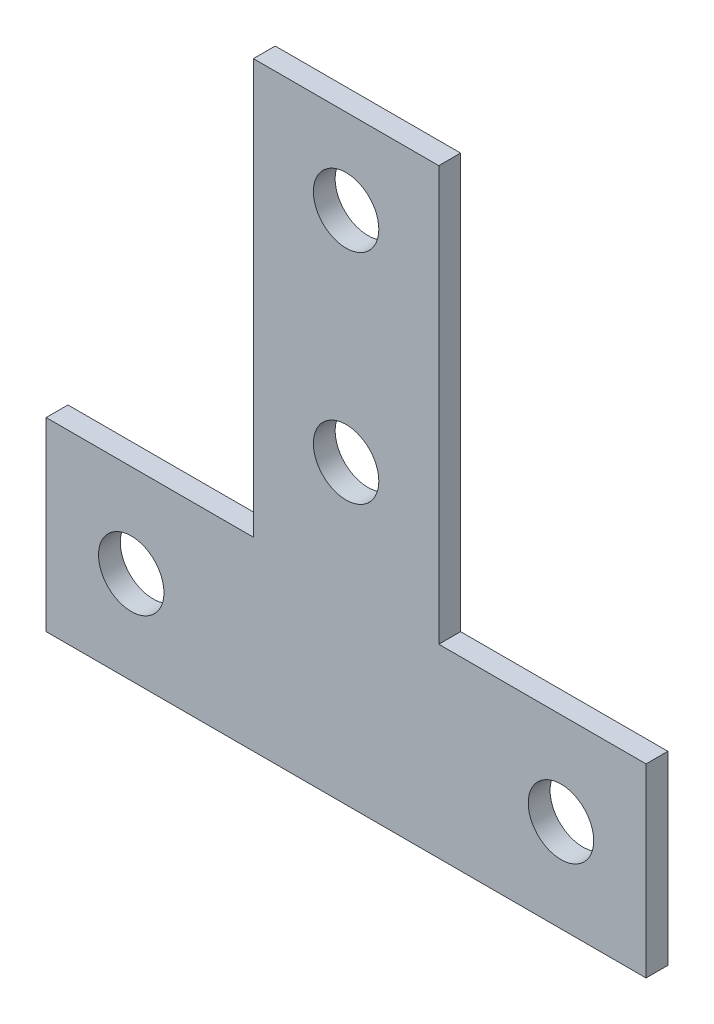
from build123d import *

# Parameters (mm, degrees)
EXTRUDE_1_DEPTH     = 2
SKETCH_2_R          = 3
CUT_EXTRUDE_1_DEPTH = 55.060151683


with BuildPart() as part:
    # 草图1 → 凸台-拉伸1 (new body)
    with BuildSketch(Plane.XY):
        Polygon((-27.5, -8.5), (27.5, -8.5), (27.5, 8.5), (8.5, 8.5), (8.5, 46.5), (-8.5, 46.5), (-8.5, 8.5), (-27.5, 8.5), align=None)
    extrude(amount=EXTRUDE_1_DEPTH)

    # 草图2 → 切除-拉伸1 (cut, through all)
    with BuildSketch(Plane.XY.offset(2)):
        with Locations((0, 38.7)):
            Circle(SKETCH_2_R)
        with Locations((0, 18.7)):
            Circle(SKETCH_2_R)
        with Locations((-19.7, 0)):
            Circle(SKETCH_2_R)
        with Locations(Location((19.7, 0, 0), (0, 0, 180))):
            Circle(SKETCH_2_R)
    extrude(amount=-CUT_EXTRUDE_1_DEPTH, mode=Mode.SUBTRACT)


solid = part.part
